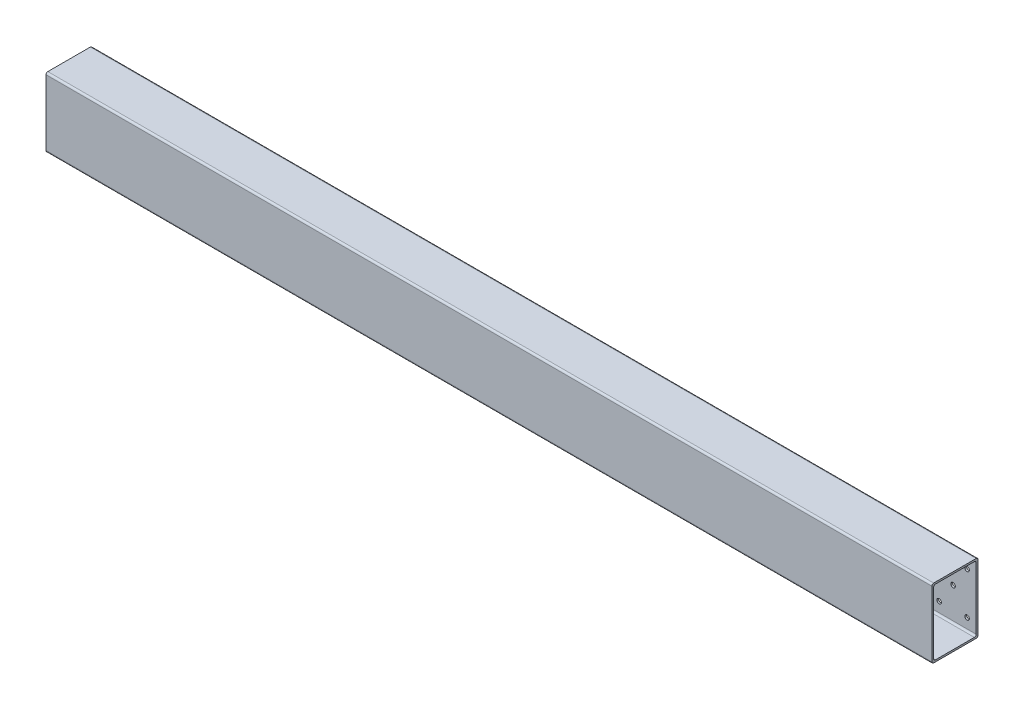
from build123d import *

# Parameters (mm, degrees)
SKETCH1_W             = 50.8
SKETCH1_H             = 76.2
BOSS_EXTRUDE1_DEPTH   = 975
SKETCH2_W             = 46.8
SKETCH2_H             = 72.2
CUT_EXTRUDE1_DEPTH    = 977.074674397
FILLET2_R             = 2
CROQUIS1_R            = 2.5
CORTAR_EXTRUIR1_DEPTH = 10
CROQUIS2_R            = 2.5
CORTAR_EXTRUIR2_DEPTH = 10
CROQUIS4_R            = 2.5
CORTAR_EXTRUIR3_DEPTH = 10
MATRIZL1_COUNT        = 17
MATRIZL1_PITCH        = 50


with BuildPart() as part:
    # Sketch1 → Boss-Extrude1 (new body)
    with BuildSketch(Plane(origin=(0, 0, 0), x_dir=(0, 0, -1), z_dir=(1, 0, 0))):
        Rectangle(SKETCH1_W, SKETCH1_H)
    extrude(amount=-BOSS_EXTRUDE1_DEPTH)

    # Sketch2 → Cut-Extrude1 (cut, through all)
    with BuildSketch(Plane(origin=(0, 0, 0), x_dir=(0, 0, -1), z_dir=(1, 0, 0))):
        Rectangle(SKETCH2_W, SKETCH2_H)
    extrude(amount=-CUT_EXTRUDE1_DEPTH, mode=Mode.SUBTRACT)

    # Fillet2
    fillet2_edges = [part.edges().sort_by_distance(p)[0] for p in [
        (-487.5, -36.1, 23.4),
        (-487.5, 36.1, 23.4),
        (-487.5, 36.1, -23.4),
        (-487.5, -36.1, -23.4),
        (-487.5, 38.1, 25.4),
        (-487.5, 38.1, -25.4),
        (-487.5, -38.1, -25.4),
        (-487.5, -38.1, 25.4),
    ]]
    fillet(fillet2_edges, radius=FILLET2_R)

    # Croquis1 → Cortar-Extruir1 (cut)
    with BuildSketch(Plane(origin=(0, 0, -25.4), x_dir=(-1, 0, 0), z_dir=(0, 0, -1))):
        with Locations(Location((25.4, 0, 0), (0, 0, 90))):
            Circle(CROQUIS1_R)
        with Locations(Location((10, 23.1, 0), (0, 0, 90))):
            Circle(CROQUIS1_R)
        with Locations(Location((10, -23.1, 0), (0, 0, 90))):
            Circle(CROQUIS1_R)
        with Locations(Location((40.8, -23.1, 0), (0, 0, 90))):
            Circle(CROQUIS1_R)
        with Locations(Location((40.8, 23.1, 0), (0, 0, 90))):
            Circle(CROQUIS1_R)
    extrude(amount=-CORTAR_EXTRUIR1_DEPTH, mode=Mode.SUBTRACT)

    # Croquis2 → Cortar-Extruir2 (cut)
    with BuildSketch(Plane(origin=(0, 0, -25.4), x_dir=(-1, 0, 0), z_dir=(0, 0, -1))):
        with Locations(Location((949.6, 0, 0), (0, 0, 90))):
            Circle(CROQUIS2_R)
        with Locations(Location((934.2, 23.1, 0), (0, 0, 90))):
            Circle(CROQUIS2_R)
        with Locations(Location((965, 23.1, 0), (0, 0, 90))):
            Circle(CROQUIS2_R)
        with Locations(Location((965, -23.1, 0), (0, 0, 90))):
            Circle(CROQUIS2_R)
        with Locations(Location((934.2, -23.1, 0), (0, 0, 90))):
            Circle(CROQUIS2_R)
    extrude(amount=-CORTAR_EXTRUIR2_DEPTH, mode=Mode.SUBTRACT)

    # Croquis4 → Cortar-Extruir3 (cut)
    with BuildSketch(Plane(origin=(0, 0, -25.4), x_dir=(-1, 0, 0), z_dir=(0, 0, -1))):
        with Locations(Location((87.5, 0, 0), (0, 0, 90))):
            Circle(CROQUIS4_R)
    cortar_extruir3 = extrude(amount=-CORTAR_EXTRUIR3_DEPTH, mode=Mode.SUBTRACT)

    # MatrizL1: Cortar-Extruir3 ×17
    with Locations(*[(-i * MATRIZL1_PITCH, 0, 0) for i in range(1, MATRIZL1_COUNT)]):
        add(cortar_extruir3, mode=Mode.SUBTRACT)


solid = part.part
